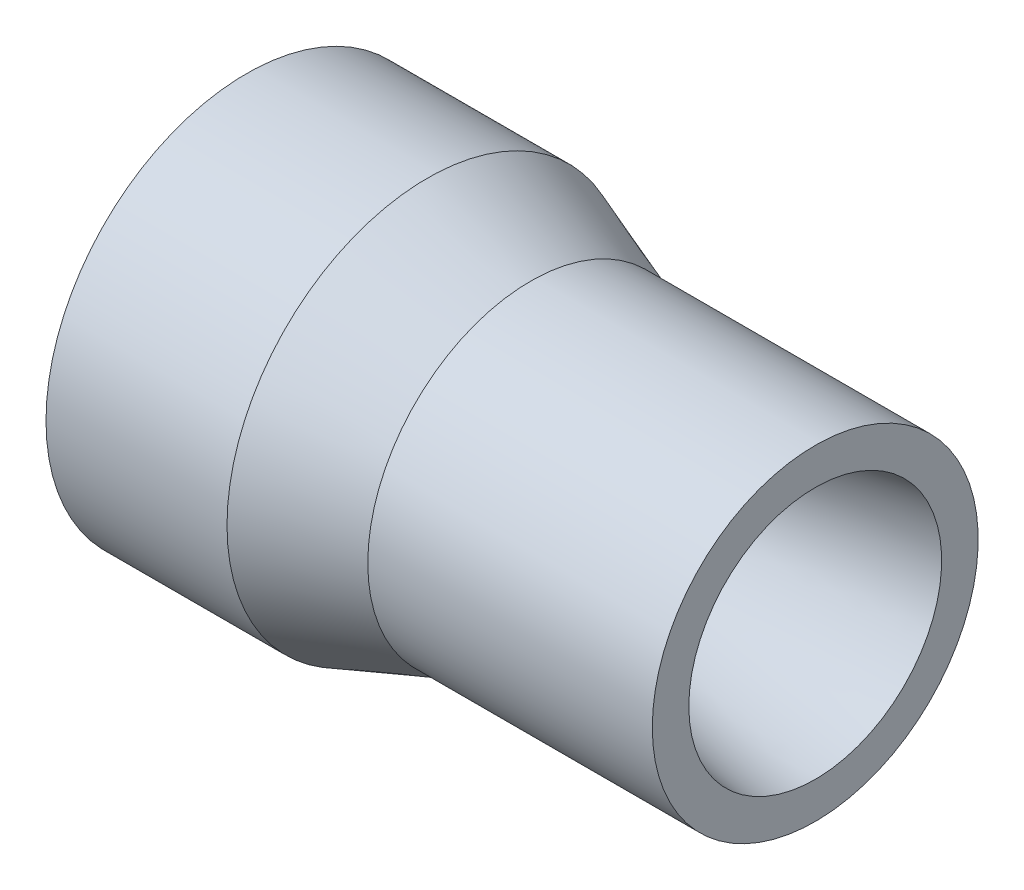
from build123d import *


with BuildPart() as part:
    # Sketch1 → Revolve1 (revolve)
    with BuildSketch(Plane.XY, mode=Mode.PRIVATE) as revolve1_sk:
        with BuildLine():
            Line((40.009783738, 31.438579704), (62.67, 18.355697745))
            ThreePointArc((62.67, 18.355697745), (68.197867486, 16.065980061), (74.13, 15.285))
            ThreePointArc((74.13, 15.285), (75.100914352, 15.366273985), (76.044804705, 15.607833794))
            add(Edge.make_bspline(
                [(76.044804705, 15.607833794), (97.235237256, 22.962250615), (126.012294015, 29.837045564), (148.34, 32.975)],
                knots=[0, 0, 0, 0, 1, 1, 1, 1], degree=3))
            Line((148.34, 32.975), (148.34, 42.5))
            Line((148.34, 42.5), (74.13, 42.5))
            Line((74.13, 42.5), (47.208567758, 52.2986))
            Line((47.208567758, 52.2986), (0, 52.2986))
            Line((0, 52.2986), (0, 42.8625))
            ThreePointArc((0, 42.8625), (20.709494319, 39.618255919), (40.009783738, 31.438579704))
        make_face()
    revolve(revolve1_sk.sketch.rotate(Axis((0, 0, 0), (1, 0, 0)), 90), axis=Axis((0, 0, 0), (1, 0, 0)))


solid = part.part
